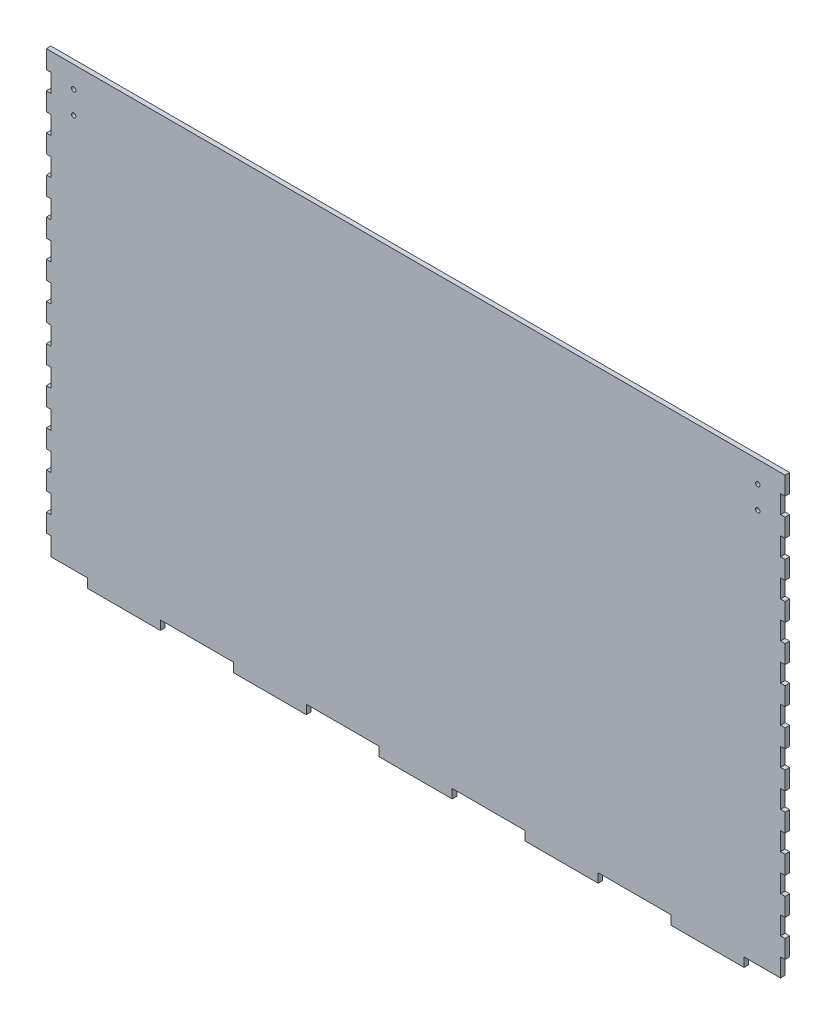
from build123d import *

# Parameters (mm, degrees)
SKETCH1_W           = 508
SKETCH1_H           = 304.8
SKETCH1_W_2         = 50.8
SKETCH1_H_2         = 6.35
SKETCH1_W_3         = 3.175
SKETCH1_H_3         = 12.7
BOSS_EXTRUDE1_DEPTH = 3.175
SKETCH2_R           = 1.5
SKETCH2_R_2         = 1.499997
CUT_EXTRUDE1_DEPTH  = 3.175


with BuildPart() as part:
    # Sketch1 → Boss-Extrude1 (new body)
    with BuildSketch(Plane.XY):
        with Locations((254, 152.4)):
            Rectangle(SKETCH1_W, SKETCH1_H)
        with Locations((50.8, -3.175)):
            Rectangle(SKETCH1_W_2, SKETCH1_H_2)
        with Locations((152.4, -3.175)):
            Rectangle(SKETCH1_W_2, SKETCH1_H_2)
        with Locations((254, -3.175)):
            Rectangle(SKETCH1_W_2, SKETCH1_H_2)
        with Locations((355.6, -3.175)):
            Rectangle(SKETCH1_W_2, SKETCH1_H_2)
        with Locations((457.2, -3.175)):
            Rectangle(SKETCH1_W_2, SKETCH1_H_2)
        with Locations((-1.5875, 19.05)):
            Rectangle(SKETCH1_W_3, SKETCH1_H_3)
        with Locations((-1.5875, 44.45)):
            Rectangle(SKETCH1_W_3, SKETCH1_H_3)
        with Locations((-1.5875, 69.85)):
            Rectangle(SKETCH1_W_3, SKETCH1_H_3)
        with Locations((-1.5875, 95.25)):
            Rectangle(SKETCH1_W_3, SKETCH1_H_3)
        with Locations((-1.5875, 120.65)):
            Rectangle(SKETCH1_W_3, SKETCH1_H_3)
        with Locations((-1.5875, 146.05)):
            Rectangle(SKETCH1_W_3, SKETCH1_H_3)
        with Locations((-1.5875, 171.45)):
            Rectangle(SKETCH1_W_3, SKETCH1_H_3)
        with Locations((-1.5875, 196.85)):
            Rectangle(SKETCH1_W_3, SKETCH1_H_3)
        with Locations((-1.5875, 222.25)):
            Rectangle(SKETCH1_W_3, SKETCH1_H_3)
        with Locations((-1.5875, 247.65)):
            Rectangle(SKETCH1_W_3, SKETCH1_H_3)
        with Locations((-1.5875, 273.05)):
            Rectangle(SKETCH1_W_3, SKETCH1_H_3)
        with Locations((-1.5875, 298.45)):
            Rectangle(SKETCH1_W_3, SKETCH1_H_3)
        with Locations((509.5875, 19.05)):
            Rectangle(SKETCH1_W_3, SKETCH1_H_3)
        with Locations((509.5875, 44.45)):
            Rectangle(SKETCH1_W_3, SKETCH1_H_3)
        with Locations((509.5875, 69.85)):
            Rectangle(SKETCH1_W_3, SKETCH1_H_3)
        with Locations((509.5875, 95.25)):
            Rectangle(SKETCH1_W_3, SKETCH1_H_3)
        with Locations((509.5875, 146.05)):
            Rectangle(SKETCH1_W_3, SKETCH1_H_3)
        with Locations((509.5875, 120.65)):
            Rectangle(SKETCH1_W_3, SKETCH1_H_3)
        with Locations((509.5875, 171.45)):
            Rectangle(SKETCH1_W_3, SKETCH1_H_3)
        with Locations((509.5875, 196.85)):
            Rectangle(SKETCH1_W_3, SKETCH1_H_3)
        with Locations((509.5875, 222.25)):
            Rectangle(SKETCH1_W_3, SKETCH1_H_3)
        with Locations((509.5875, 247.65)):
            Rectangle(SKETCH1_W_3, SKETCH1_H_3)
        with Locations((509.5875, 273.05)):
            Rectangle(SKETCH1_W_3, SKETCH1_H_3)
        with Locations((509.5875, 298.45)):
            Rectangle(SKETCH1_W_3, SKETCH1_H_3)
    extrude(amount=BOSS_EXTRUDE1_DEPTH)

    # Sketch2 → Cut-Extrude1 (cut)
    with BuildSketch(Plane.XY.offset(3.175)):
        with Locations((15.875, 289.8)):
            Circle(SKETCH2_R)
        with Locations((15.875, 274.05)):
            Circle(SKETCH2_R_2)
        with Locations((492.125, 289.8)):
            Circle(SKETCH2_R)
        with Locations((492.125, 274.05)):
            Circle(SKETCH2_R_2)
    extrude(amount=-CUT_EXTRUDE1_DEPTH, mode=Mode.SUBTRACT)


solid = part.part
